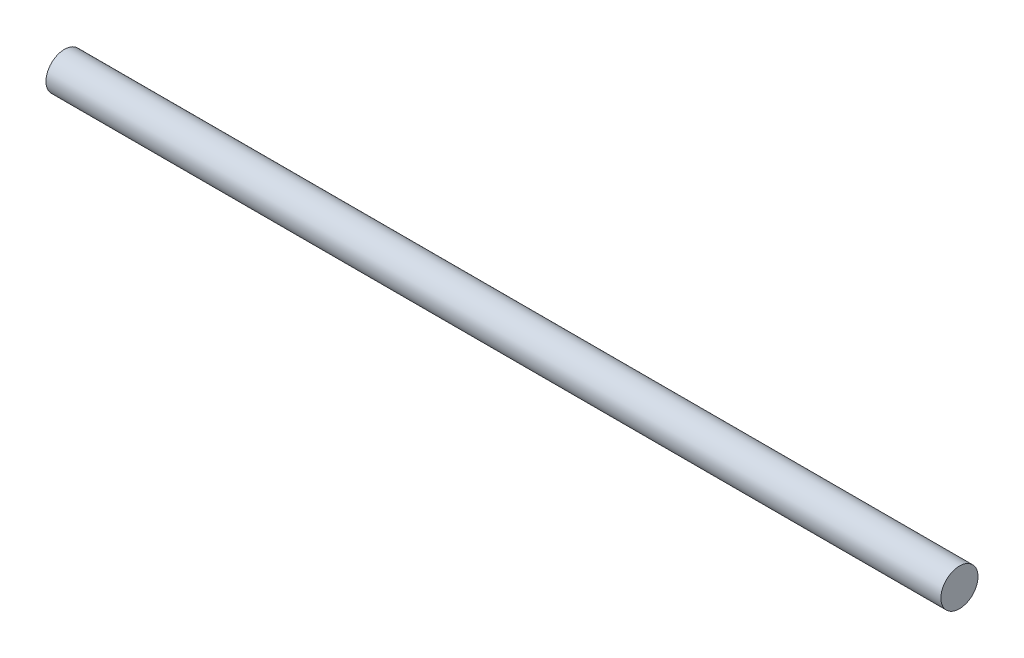
from build123d import *

# Parameters (mm, degrees)
BOSS_EXTRUDE1_DEPTH      = 2205.6
BOSS_EXTRUDE1_DEPTH_BACK = 207.027297066
SKETCH1_R                = 50


with BuildPart() as part:
    # Sketch1 → Boss-Extrude1 (new, two sides: drawn at the far end of the back side and taken through both)
    with BuildSketch(Plane(origin=(0, 0, 0), x_dir=(0, 0, -1), z_dir=(1, 0, 0)).offset(-BOSS_EXTRUDE1_DEPTH_BACK)):
        Circle(SKETCH1_R)
    extrude(amount=BOSS_EXTRUDE1_DEPTH + BOSS_EXTRUDE1_DEPTH_BACK)


solid = part.part
